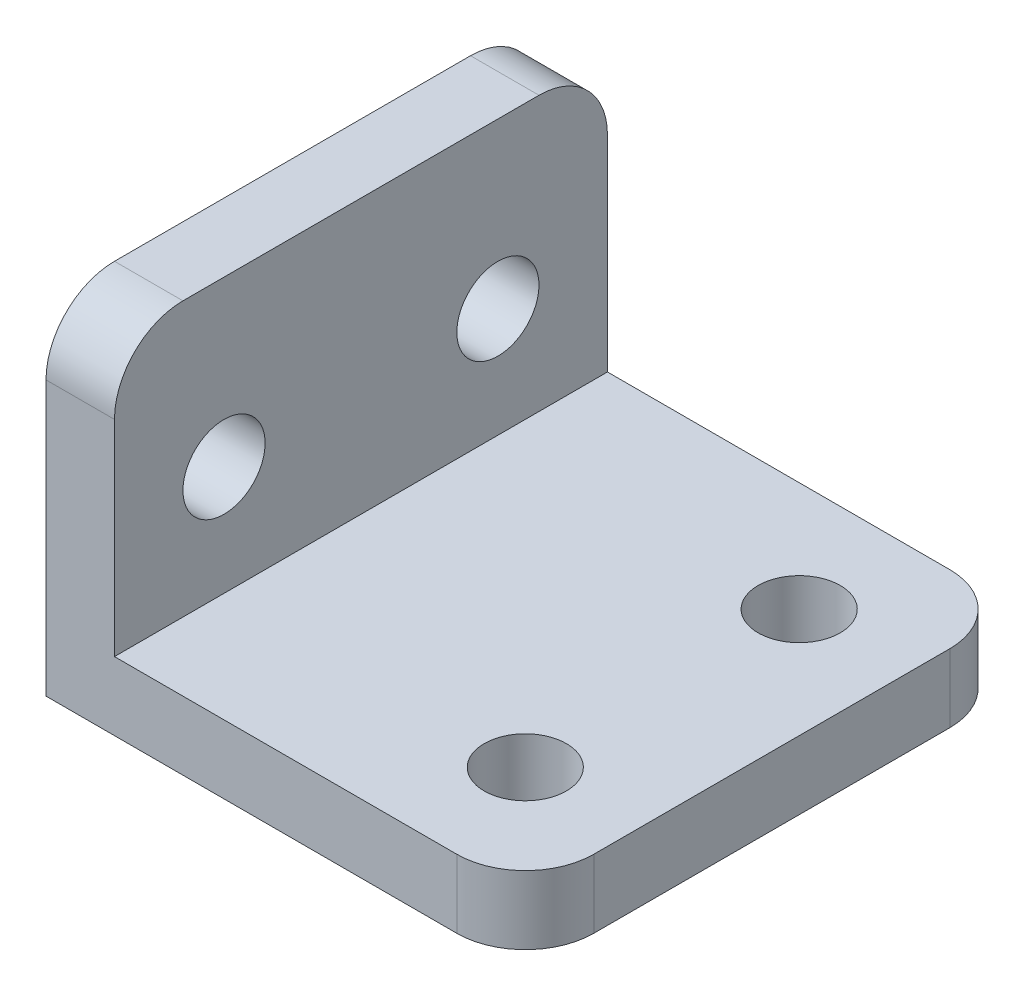
from build123d import *

# Parameters (mm, degrees)
BOSS_EXTRUDE1_DEPTH = 36
SKETCH2_R           = 3
CUT_EXTRUDE1_DEPTH  = 5
SKETCH3_R           = 3
CUT_EXTRUDE2_DEPTH  = 5
FILLET1_R           = 5


with BuildPart() as part:
    # Sketch1 → Boss-Extrude1 (new body)
    with BuildSketch(Plane.XY):
        Polygon((0, 19.095465902), (0, -0.904534098), (30, -0.904534098), (30, -5.904534098), (-5, -5.904534098), (-5, 19.095465902), align=None)
    extrude(amount=BOSS_EXTRUDE1_DEPTH)

    # Sketch2 → Cut-Extrude1 (cut)
    with BuildSketch(Plane(origin=(0, -0.904534098, 0), x_dir=(1, 0, 0), z_dir=(0, 1, 0))):
        with Locations(Location((22, -8, 0), (0, 0, 180))):
            Circle(SKETCH2_R)
        with Locations(Location((22, -28, 0), (0, 0, 180))):
            Circle(SKETCH2_R)
    extrude(amount=-CUT_EXTRUDE1_DEPTH, mode=Mode.SUBTRACT)

    # Sketch3 → Cut-Extrude2 (cut)
    with BuildSketch(Plane(origin=(0, 0, 0), x_dir=(0, 0, -1), z_dir=(1, 0, 0))):
        with Locations(Location((-28, 7.095465902, 0), (0, 0, 90))):
            Circle(SKETCH3_R)
        with Locations(Location((-8, 7.095465902, 0), (0, 0, 90))):
            Circle(SKETCH3_R)
    extrude(amount=-CUT_EXTRUDE2_DEPTH, mode=Mode.SUBTRACT)

    # Fillet1
    fillet1_edges = [part.edges().sort_by_distance(p)[0] for p in [
        (30, -3.404534098, 36),
        (-2.5, 19.095465902, 36),
        (30, -3.404534098, 0),
        (-2.5, 19.095465902, 0),
    ]]
    fillet(fillet1_edges, radius=FILLET1_R)


solid = part.part
